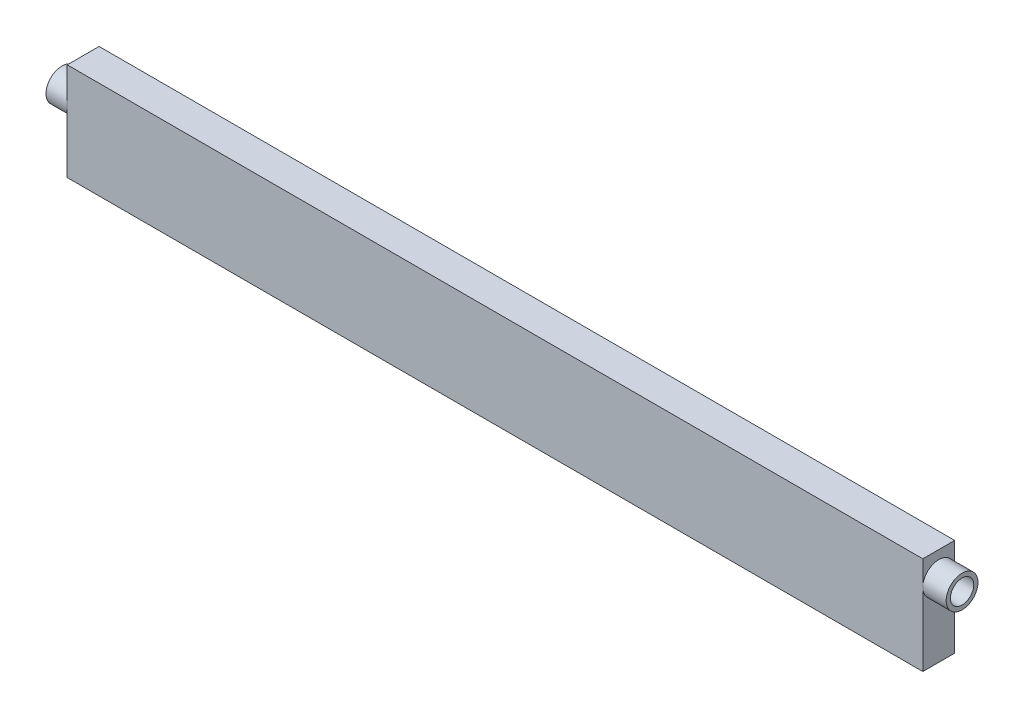
from build123d import *

# Parameters (mm, degrees)
DODANIE_WYCI_GNI_CIE1_DEPTH      = 12
DODANIE_WYCI_GNI_CIE1_2_DEPTH    = 12
DODANIE_WYCI_GNI_CIE1_3_DEPTH    = 12
DODANIE_WYCI_GNI_CIE1_4_DEPTH    = 12
DODANIE_WYCI_GNI_CIE1_5_DEPTH    = 12
DODANIE_WYCI_GNI_CIE1_6_DEPTH    = 12
DODANIE_WYCI_GNI_CIE1_7_DEPTH    = 12
DODANIE_WYCI_GNI_CIE1_8_DEPTH    = 12
DODANIE_WYCI_GNI_CIE1_9_DEPTH    = 12
DODANIE_WYCI_GNI_CIE1_10_DEPTH   = 12
DODANIE_WYCI_GNI_CIE1_11_DEPTH   = 12
DODANIE_WYCI_GNI_CIE1_12_DEPTH   = 12
DODANIE_WYCI_GNI_CIE1_13_DEPTH   = 12
DODANIE_WYCI_GNI_CIE1_14_DEPTH   = 12
SZKIC1_3_W                       = 403
SZKIC1_3_H                       = 46
DODANIE_WYCI_GNI_CIE2_DEPTH      = 1.5
DODANIE_WYCI_GNI_CIE3_START      = 12
SZKIC1_4_W                       = 403
SZKIC1_4_H                       = 46
DODANIE_WYCI_GNI_CIE3_DEPTH      = 1.5
DODANIE_WYCI_GNI_CIE6_DEPTH      = 10
DODANIE_WYCI_GNI_CIE6_DEPTH_BACK = 2
SZKIC2_R                         = 7.5
SZKIC3_R                         = 5.5
WYTNIJ_WYCI_GNI_CIE1_DEPTH       = 18
DODANIE_WYCI_GNI_CIE8_DEPTH      = 11
DODANIE_WYCI_GNI_CIE8_DEPTH_BACK = 2
SZKIC4_R                         = 7.5
SZKIC4_R_2                       = 5.5
SZKIC4_2_R                       = 5.5
WYTNIJ_WYCI_GNI_CIE2_DEPTH       = 9


with BuildPart() as part:
    # Szkic1 → Dodanie-wyciągnięcie1 (new body)
    with BuildSketch(Plane.XY):
        with BuildLine():
            Line((0, 46), (0, 33))
            Line((0, 33), (26.792506443, 44.097819539))
            ThreePointArc((26.792506443, 44.097819539), (43.03114959, 35.902698996), (32.510997896, 21.064237475))
            Line((32.510997896, 21.064237475), (34.358756961, 20.29887061))
            Line((34.358756961, 20.29887061), (91.814502235, 44.097819539))
            ThreePointArc((91.814502235, 44.097819539), (108.053145382, 35.902698996), (97.532993688, 21.064237475))
            Line((97.532993688, 21.064237475), (99.380752753, 20.29887061))
            Line((99.380752753, 20.29887061), (156.836498027, 44.097819539))
            ThreePointArc((156.836498027, 44.097819539), (173.075141175, 35.902698996), (162.55498948, 21.064237475))
            Line((162.55498948, 21.064237475), (164.402748545, 20.29887061))
            Line((164.402748545, 20.29887061), (221.858493819, 44.097819539))
            ThreePointArc((221.858493819, 44.097819539), (238.097136967, 35.902698996), (227.576985273, 21.064237475))
            Line((227.576985273, 21.064237475), (229.424744338, 20.29887061))
            Line((229.424744338, 20.29887061), (286.880489611, 44.097819539))
            ThreePointArc((286.880489611, 44.097819539), (303.119132759, 35.902698996), (292.598981065, 21.064237475))
            Line((292.598981065, 21.064237475), (294.44674013, 20.29887061))
            Line((294.44674013, 20.29887061), (351.902485404, 44.097819539))
            ThreePointArc((351.902485404, 44.097819539), (368.141128551, 35.902698996), (357.620976857, 21.064237475))
            Line((357.620976857, 21.064237475), (359.468735922, 20.29887061))
            Line((359.468735922, 20.29887061), (403, 38.330110578))
            Line((403, 38.330110578), (403, 46))
            Line((403, 46), (0, 46))
        make_face()
    extrude(amount=DODANIE_WYCI_GNI_CIE1_DEPTH)



with BuildPart() as body_2:
    # Szkic1 → Dodanie-wyci_gni_cie1 2 (new body)
    with BuildSketch(Plane.XY):
        with BuildLine():
            Line((1.847759065, 26.188621463), (0, 25.423254598))
            Line((0, 25.423254598), (0, 0))
            Line((0, 0), (403, 0))
            Line((403, 0), (403, 30.753365176))
            Line((403, 30.753365176), (390.131974753, 25.423254598))
            ThreePointArc((390.131974753, 25.423254598), (400.652126447, 10.584793077), (384.4134833, 2.389672534))
            Line((384.4134833, 2.389672534), (326.957738026, 26.188621463))
            Line((326.957738026, 26.188621463), (325.109978961, 25.423254598))
            ThreePointArc((325.109978961, 25.423254598), (335.630130655, 10.584793077), (319.391487508, 2.389672534))
            Line((319.391487508, 2.389672534), (261.935742234, 26.188621463))
            Line((261.935742234, 26.188621463), (260.087983169, 25.423254598))
            ThreePointArc((260.087983169, 25.423254598), (270.608134863, 10.584793077), (254.369491715, 2.389672534))
            Line((254.369491715, 2.389672534), (196.913746441, 26.188621463))
            Line((196.913746441, 26.188621463), (195.065987376, 25.423254598))
            ThreePointArc((195.065987376, 25.423254598), (205.586139071, 10.584793077), (189.347495923, 2.389672534))
            Line((189.347495923, 2.389672534), (131.891750649, 26.188621463))
            Line((131.891750649, 26.188621463), (130.043991584, 25.423254598))
            ThreePointArc((130.043991584, 25.423254598), (140.564143279, 10.584793077), (124.325500131, 2.389672534))
            Line((124.325500131, 2.389672534), (66.869754857, 26.188621463))
            Line((66.869754857, 26.188621463), (65.021995792, 25.423254598))
            ThreePointArc((65.021995792, 25.423254598), (75.542147486, 10.584793077), (59.303504339, 2.389672534))
            Line((59.303504339, 2.389672534), (1.847759065, 26.188621463))
        make_face()
    extrude(amount=DODANIE_WYCI_GNI_CIE1_2_DEPTH)


with BuildPart() as body_3:
    # Szkic1 → Dodanie-wyci_gni_cie1 3 (new body)
    with BuildSketch(Plane.XY):
        with BuildLine():
            Line((29.471290469, 37.630662811), (10.993699819, 29.976994164))
            Line((10.993699819, 29.976994164), (24.059329468, 24.565033162))
            Line((24.059329468, 24.565033162), (33.298124793, 28.391867486))
            ThreePointArc((33.298124793, 28.391867486), (36.004105294, 34.92468231), (29.471290469, 37.630662811))
        make_face()
    extrude(amount=DODANIE_WYCI_GNI_CIE1_3_DEPTH)


with BuildPart() as body_4:
    # Szkic1 → Dodanie-wyci_gni_cie1 4 (new body)
    with BuildSketch(Plane.XY):
        with BuildLine():
            Line((56.570327364, 21.92245891), (43.504697715, 16.510497909))
            Line((43.504697715, 16.510497909), (61.982288365, 8.856829262))
            ThreePointArc((61.982288365, 8.856829262), (68.51510319, 11.562809762), (65.809122689, 18.095624587))
            Line((65.809122689, 18.095624587), (56.570327364, 21.92245891))
        make_face()
    extrude(amount=DODANIE_WYCI_GNI_CIE1_4_DEPTH)


with BuildPart() as body_5:
    # Szkic1 → Dodanie-wyci_gni_cie1 5 (new body)
    with BuildSketch(Plane.XY):
        with BuildLine():
            Line((94.493286262, 37.630662811), (76.015695611, 29.976994164))
            Line((76.015695611, 29.976994164), (89.08132526, 24.565033162))
            Line((89.08132526, 24.565033162), (98.320120585, 28.391867486))
            ThreePointArc((98.320120585, 28.391867486), (101.026101086, 34.92468231), (94.493286262, 37.630662811))
        make_face()
    extrude(amount=DODANIE_WYCI_GNI_CIE1_5_DEPTH)


with BuildPart() as body_6:
    # Szkic1 → Dodanie-wyci_gni_cie1 6 (new body)
    with BuildSketch(Plane.XY):
        with BuildLine():
            Line((130.831118481, 18.095624587), (121.592323156, 21.92245891))
            Line((121.592323156, 21.92245891), (108.526693507, 16.510497909))
            Line((108.526693507, 16.510497909), (127.004284158, 8.856829262))
            ThreePointArc((127.004284158, 8.856829262), (133.537098982, 11.562809762), (130.831118481, 18.095624587))
        make_face()
    extrude(amount=DODANIE_WYCI_GNI_CIE1_6_DEPTH)


with BuildPart() as body_7:
    # Szkic1 → Dodanie-wyci_gni_cie1 7 (new body)
    with BuildSketch(Plane.XY):
        with BuildLine():
            Line((159.515282054, 37.630662811), (141.037691403, 29.976994164))
            Line((141.037691403, 29.976994164), (154.103321052, 24.565033162))
            Line((154.103321052, 24.565033162), (163.342116377, 28.391867486))
            ThreePointArc((163.342116377, 28.391867486), (166.048096878, 34.92468231), (159.515282054, 37.630662811))
        make_face()
    extrude(amount=DODANIE_WYCI_GNI_CIE1_7_DEPTH)


with BuildPart() as body_8:
    # Szkic1 → Dodanie-wyci_gni_cie1 8 (new body)
    with BuildSketch(Plane.XY):
        with BuildLine():
            Line((195.853114273, 18.095624587), (186.614318948, 21.92245891))
            Line((186.614318948, 21.92245891), (173.5486893, 16.510497909))
            Line((173.5486893, 16.510497909), (192.02627995, 8.856829262))
            ThreePointArc((192.02627995, 8.856829262), (198.559094774, 11.562809762), (195.853114273, 18.095624587))
        make_face()
    extrude(amount=DODANIE_WYCI_GNI_CIE1_8_DEPTH)


with BuildPart() as body_9:
    # Szkic1 → Dodanie-wyci_gni_cie1 9 (new body)
    with BuildSketch(Plane.XY):
        with BuildLine():
            Line((224.537277846, 37.630662811), (206.059687196, 29.976994164))
            Line((206.059687196, 29.976994164), (219.125316844, 24.565033162))
            Line((219.125316844, 24.565033162), (228.364112169, 28.391867486))
            ThreePointArc((228.364112169, 28.391867486), (231.07009267, 34.92468231), (224.537277846, 37.630662811))
        make_face()
    extrude(amount=DODANIE_WYCI_GNI_CIE1_9_DEPTH)


with BuildPart() as body_10:
    # Szkic1 → Dodanie-wyci_gni_cie1 10 (new body)
    with BuildSketch(Plane.XY):
        with BuildLine():
            Line((260.875110066, 18.095624587), (251.63631474, 21.92245891))
            Line((251.63631474, 21.92245891), (238.570685092, 16.510497909))
            Line((238.570685092, 16.510497909), (257.048275742, 8.856829262))
            ThreePointArc((257.048275742, 8.856829262), (263.581090566, 11.562809762), (260.875110066, 18.095624587))
        make_face()
    extrude(amount=DODANIE_WYCI_GNI_CIE1_10_DEPTH)


with BuildPart() as body_11:
    # Szkic1 → Dodanie-wyci_gni_cie1 11 (new body)
    with BuildSketch(Plane.XY):
        with BuildLine():
            Line((289.559273638, 37.630662811), (271.081682988, 29.976994164))
            Line((271.081682988, 29.976994164), (284.147312637, 24.565033162))
            Line((284.147312637, 24.565033162), (293.386107962, 28.391867486))
            ThreePointArc((293.386107962, 28.391867486), (296.092088462, 34.92468231), (289.559273638, 37.630662811))
        make_face()
    extrude(amount=DODANIE_WYCI_GNI_CIE1_11_DEPTH)


with BuildPart() as body_12:
    # Szkic1 → Dodanie-wyci_gni_cie1 12 (new body)
    with BuildSketch(Plane.XY):
        with BuildLine():
            Line((325.897105858, 18.095624587), (316.658310533, 21.92245891))
            Line((316.658310533, 21.92245891), (303.592680884, 16.510497909))
            Line((303.592680884, 16.510497909), (322.070271534, 8.856829262))
            ThreePointArc((322.070271534, 8.856829262), (328.603086358, 11.562809762), (325.897105858, 18.095624587))
        make_face()
    extrude(amount=DODANIE_WYCI_GNI_CIE1_12_DEPTH)


with BuildPart() as body_13:
    # Szkic1 → Dodanie-wyci_gni_cie1 13 (new body)
    with BuildSketch(Plane.XY):
        with BuildLine():
            Line((354.58126943, 37.630662811), (336.10367878, 29.976994164))
            Line((336.10367878, 29.976994164), (349.169308429, 24.565033162))
            Line((349.169308429, 24.565033162), (358.408103754, 28.391867486))
            ThreePointArc((358.408103754, 28.391867486), (361.114084255, 34.92468231), (354.58126943, 37.630662811))
        make_face()
    extrude(amount=DODANIE_WYCI_GNI_CIE1_13_DEPTH)


with BuildPart() as body_14:
    # Szkic1 → Dodanie-wyci_gni_cie1 14 (new body)
    with BuildSketch(Plane.XY):
        with BuildLine():
            Line((390.91910165, 18.095624587), (381.680306325, 21.92245891))
            Line((381.680306325, 21.92245891), (368.614676676, 16.510497909))
            Line((368.614676676, 16.510497909), (387.092267326, 8.856829262))
            ThreePointArc((387.092267326, 8.856829262), (393.625082151, 11.562809762), (390.91910165, 18.095624587))
        make_face()
    extrude(amount=DODANIE_WYCI_GNI_CIE1_14_DEPTH)


with BuildPart() as part_1:
    add(part.part)

    add(body_2.part)  # Dodanie-wyciągnięcie2 merges body 2

    add(body_3.part)  # Dodanie-wyciągnięcie2 merges body 3

    add(body_4.part)  # Dodanie-wyciągnięcie2 merges body 4

    add(body_5.part)  # Dodanie-wyciągnięcie2 merges body 5

    add(body_6.part)  # Dodanie-wyciągnięcie2 merges body 6

    add(body_7.part)  # Dodanie-wyciągnięcie2 merges body 7

    add(body_8.part)  # Dodanie-wyciągnięcie2 merges body 8

    add(body_9.part)  # Dodanie-wyciągnięcie2 merges body 9

    add(body_10.part)  # Dodanie-wyciągnięcie2 merges body 10

    add(body_11.part)  # Dodanie-wyciągnięcie2 merges body 11

    add(body_12.part)  # Dodanie-wyciągnięcie2 merges body 12

    add(body_13.part)  # Dodanie-wyciągnięcie2 merges body 13

    add(body_14.part)  # Dodanie-wyciągnięcie2 merges body 14
    # Szkic1<3> → Dodanie-wyciągnięcie2 (add)
    with BuildSketch(Plane.XY):
        with Locations((201.5, 23)):
            Rectangle(SZKIC1_3_W, SZKIC1_3_H)
    extrude(amount=-DODANIE_WYCI_GNI_CIE2_DEPTH)

    # Szkic1<4> → Dodanie-wyciągnięcie3 (add)
    with BuildSketch(Plane.XY.offset(DODANIE_WYCI_GNI_CIE3_START)):
        with Locations((201.5, 23)):
            Rectangle(SZKIC1_4_W, SZKIC1_4_H)
    extrude(amount=DODANIE_WYCI_GNI_CIE3_DEPTH)

    # Szkic2 → Dodanie-wyciągnięcie6 (add, two sides: drawn at the far end of the back side and taken through both)
    with BuildSketch(Plane.ZY.offset(-DODANIE_WYCI_GNI_CIE6_DEPTH_BACK)):
        with Locations((6, 29.25)):
            Circle(SZKIC2_R)
    extrude(amount=DODANIE_WYCI_GNI_CIE6_DEPTH + DODANIE_WYCI_GNI_CIE6_DEPTH_BACK)

    # Szkic3 → Wytnij-wyciągnięcie1 (cut)
    with BuildSketch(Plane.ZY.offset(10)):
        with Locations((6, 29.25)):
            Circle(SZKIC3_R)
    extrude(amount=-WYTNIJ_WYCI_GNI_CIE1_DEPTH, mode=Mode.SUBTRACT)

    # Szkic4 → Dodanie-wyciągnięcie8 (add, two sides: drawn at the far end of the back side and taken through both)
    with BuildSketch(Plane(origin=(403, 0, 0), x_dir=(0, 0, -1), z_dir=(1, 0, 0)).offset(-DODANIE_WYCI_GNI_CIE8_DEPTH_BACK)):
        with Locations((-6, 34.4)):
            Circle(SZKIC4_R)
        with Locations((-6, 34.4)):
            Circle(SZKIC4_R_2, mode=Mode.SUBTRACT)
    extrude(amount=DODANIE_WYCI_GNI_CIE8_DEPTH + DODANIE_WYCI_GNI_CIE8_DEPTH_BACK)

    # Szkic4<2> → Wytnij-wyciągnięcie2 (cut)
    with BuildSketch(Plane(origin=(403, 0, 0), x_dir=(0, 0, -1), z_dir=(1, 0, 0))):
        with Locations((-6, 34.4)):
            Circle(SZKIC4_2_R)
    extrude(amount=-WYTNIJ_WYCI_GNI_CIE2_DEPTH, mode=Mode.SUBTRACT)


solid = part_1.part
